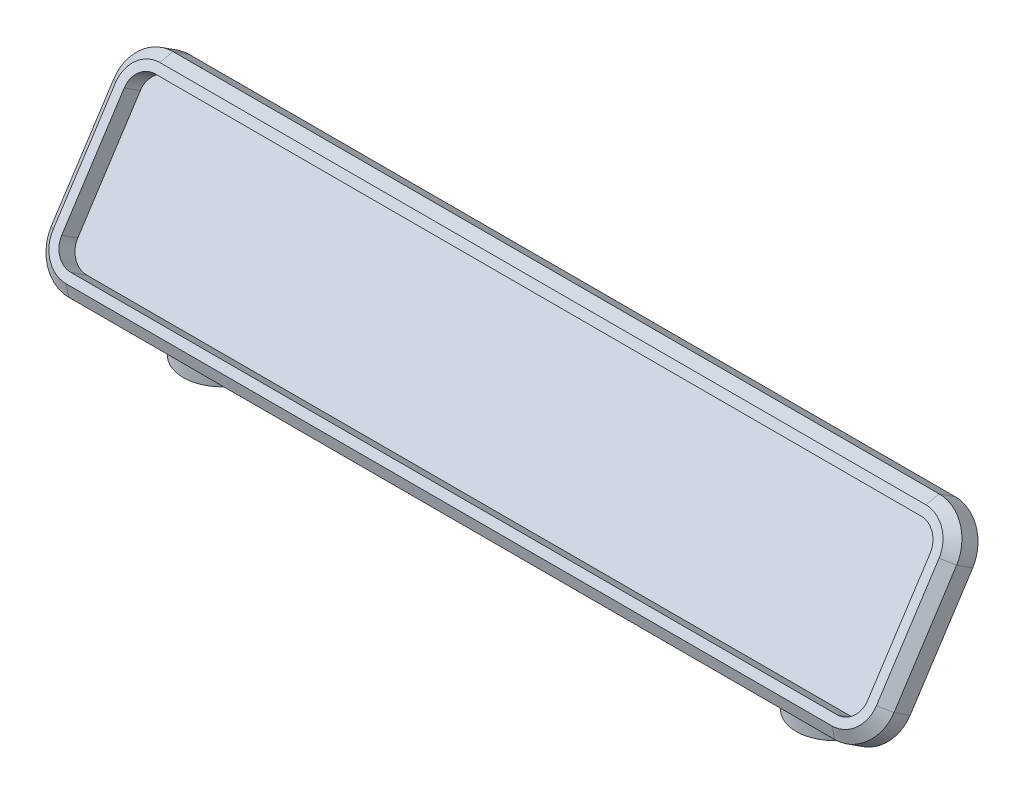
from build123d import *

# Parameters (mm, degrees)
SKETCH2_R             = 6.35
BOSS_EXTRUDE1_DEPTH   = 19.05
BOSS_EXTRUDE1_2_DEPTH = 19.05
BOSS_EXTRUDE2_DEPTH   = 6.35
BOSS_EXTRUDE3_REACH   = 75.737
CUT_EXTRUDE1_DEPTH    = 3.175
CHAMFER2_SIZE         = 1.5875
HOLE1_D               = 5.715
HOLE1_DEPTH           = 10.16
HOLE1_CBORE_D         = 6.985
HOLE1_CBORE_DEPTH     = 0.6858


with BuildPart() as part:
    # Sketch2 → Boss-Extrude1 (new body)
    with BuildSketch(Plane(origin=(0, 0, 0), x_dir=(1, 0, 0), z_dir=(0, 1, 0))):
        with Locations((-50.8, 0)):
            Circle(SKETCH2_R)
    extrude(amount=BOSS_EXTRUDE1_DEPTH)



with BuildPart() as body_2:
    # Sketch2 → Boss-Extrude1 2 (new body)
    with BuildSketch(Plane(origin=(0, 0, 0), x_dir=(1, 0, 0), z_dir=(0, 1, 0))):
        with Locations((50.8, 0)):
            Circle(SKETCH2_R)
    extrude(amount=BOSS_EXTRUDE1_2_DEPTH)


with BuildPart() as part_1:
    add(part.part)

    add(body_2.part)  # Boss-Extrude2 merges body 2
    # Sketch3 → Boss-Extrude2 (add)
    with BuildSketch(Plane(origin=(0, 5.650833475, 8.701520484), x_dir=(-1, 0, 0), z_dir=(0, 0.5446390350150281, 0.8386705679454234))):
        with BuildLine():
            ThreePointArc((-69.85, -25.501674319), (-67.990128061, -29.99180238), (-63.5, -31.851674319))
            Line((-63.5, -31.851674319), (63.5, -31.851674319))
            ThreePointArc((63.5, -31.851674319), (67.990128061, -29.99180238), (69.85, -25.501674319))
            Line((69.85, -25.501674319), (69.85, -6.451674319))
            ThreePointArc((69.85, -6.451674319), (67.990128061, -1.961546259), (63.5, -0.101674319))
            Line((63.5, -0.101674319), (-63.5, -0.101674319))
            ThreePointArc((-63.5, -0.101674319), (-67.990128061, -1.961546259), (-69.85, -6.451674319))
            Line((-69.85, -6.451674319), (-69.85, -25.501674319))
        make_face()
    extrude(amount=BOSS_EXTRUDE2_DEPTH)

    # Sketch8 → Boss-Extrude3 (add, up to next)
    with BuildSketch(Plane(origin=(0, 19.05, 0), x_dir=(1, 0, 0), z_dir=(0, 1, 0)), mode=Mode.PRIVATE) as boss_extrude3_sk1:
        with BuildLine():
            ThreePointArc((57.15, 0), (50.8, 6.35), (44.45, 0))
            Line((44.45, 0), (57.15, 0))
        make_face()
    boss_extrude3_tool1 = extrude(boss_extrude3_sk1.sketch, amount=BOSS_EXTRUDE3_REACH, mode=Mode.PRIVATE) - part_1.part
    # Sketch8 → Boss-Extrude3 (add, up to next)
    with BuildSketch(Plane(origin=(0, 19.05, 0), x_dir=(1, 0, 0), z_dir=(0, 1, 0)), mode=Mode.PRIVATE) as boss_extrude3_sk2:
        with BuildLine():
            ThreePointArc((-44.45, 0), (-50.8, 6.35), (-57.15, 0))
            Line((-57.15, 0), (-44.45, 0))
        make_face()
    boss_extrude3_tool2 = extrude(boss_extrude3_sk2.sketch, amount=BOSS_EXTRUDE3_REACH, mode=Mode.PRIVATE) - part_1.part
    add(boss_extrude3_tool1.solids().sort_by_distance((50.8, 19.05, -2.695024))[0])
    add(boss_extrude3_tool2.solids().sort_by_distance((-50.8, 19.05, -2.695024))[0])

    # Sketch9 → Cut-Extrude1 (cut)
    with BuildSketch(Plane(origin=(0, 9.109291347, 14.02707859), x_dir=(1, 0, 0), z_dir=(0, 0.5446390350150282, 0.8386705679454234))):
        with BuildLine():
            Line((63.5, 28.803674319), (-63.5, 28.803674319))
            ThreePointArc((-63.5, 28.803674319), (-65.834866591, 27.836540911), (-66.802, 25.501674319))
            Line((-66.802, 25.501674319), (-66.802, 6.451674319))
            ThreePointArc((-66.802, 6.451674319), (-65.834866591, 4.116807728), (-63.5, 3.149674319))
            Line((-63.5, 3.149674319), (63.5, 3.149674319))
            ThreePointArc((63.5, 3.149674319), (65.834866591, 4.116807728), (66.802, 6.451674319))
            Line((66.802, 6.451674319), (66.802, 25.501674319))
            ThreePointArc((66.802, 25.501674319), (65.834866591, 27.836540911), (63.5, 28.803674319))
        make_face()
    extrude(amount=-CUT_EXTRUDE1_DEPTH, mode=Mode.SUBTRACT)

    # Chamfer2
    chamfer2_edges = [part_1.edges().sort_by_distance(p)[0] for p in [
        (-69.85, 19.05, 0),
        (0, 32.363895266, -8.646144681),
        (69.85, 19.05, 0),
        (0, 5.736104734, 8.646144681),
        (0, 9.194562606, 13.971702787),
        (-69.85, 22.508457872, 5.325558106),
        (69.85, 22.508457872, 5.325558106),
        (0, 35.822353138, -3.320586574),
        (67.990128061, 30.80407541, -7.633185823),
        (-67.990128061, 30.80407541, -7.633185823),
        (67.990128061, 7.29592459, 7.633185823),
        (-67.990128061, 7.29592459, 7.633185823),
        (67.990128061, 10.754382462, 12.958743929),
        (-67.990128061, 10.754382462, 12.958743929),
        (67.990128061, 34.262533283, -2.307627716),
        (-67.990128061, 34.262533283, -2.307627716),
    ]]
    chamfer(chamfer2_edges, length=CHAMFER2_SIZE)

    # Hole1
    with Locations(Plane(origin=(-50.8, 0, 0), x_dir=(0, 0, -1), z_dir=(0, -1, 0))):
        with Locations((0, 0), (0, 101.6)):
            CounterBoreHole(HOLE1_D / 2, HOLE1_CBORE_D / 2, HOLE1_CBORE_DEPTH, depth=HOLE1_DEPTH)


solid = part_1.part
